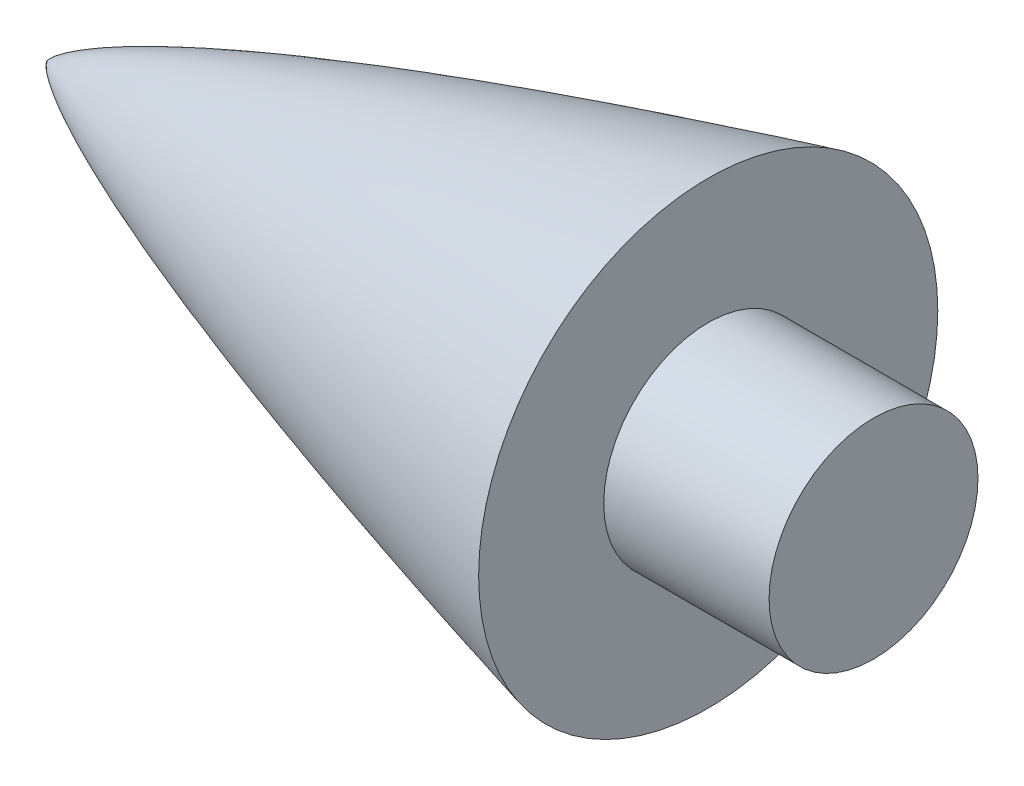
from build123d import *

# Parameters (mm, degrees)
SKETCH5_W           = 40
SKETCH5_H           = 13.888133248
SKETCH6_R           = 6.32
BOSS_EXTRUDE1_DEPTH = 10


with BuildPart() as part:
    # Sketch4 → Revolve3 (revolve)
    with BuildSketch(Plane(origin=(0, 0, 0), x_dir=(1, 0, 0), z_dir=(0, 1, 0))):
        with BuildLine():
            Line((0, 0), (700, 0))
            Line((700, 0), (700, 92))
            add(Edge.make_bspline(
                [(0, 0), (0.00191147, 0.007452455), (0.006682771, 0.021975667), (0.020319911, 0.049405272), (0.053712312, 0.100813891), (0.106292543, 0.166564672), (0.179361524, 0.244890293), (0.321314168, 0.380305786), (0.489821471, 0.519272356), (0.682008296, 0.663619163), (0.97824001, 0.869271861), (1.381516871, 1.128290995), (2.087665161, 1.540864263), (3.352844681, 2.20038034), (5.559362022, 3.217605874), (9.551431072, 4.830778204), (16.8107271, 7.377330859), (28.917425512, 11.039410523), (45.357311817, 15.359469167), (65.219754515, 20.019307373), (92.239595195, 25.797411612), (124.65879636, 32.080212127), (162.600367905, 38.763077948), (206.074460711, 45.728609064), (249.632824355, 52.143059314), (293.258988419, 58.07761177), (336.942021596, 63.576842057), (380.674593437, 68.666747534), (424.45146039, 73.360146302), (468.268944021, 77.658075094), (512.124428867, 81.549646326), (556.016196354, 85.009603585), (594.452384, 87.618355269), (627.419605801, 89.502855515), (653.668023827, 90.726417336), (671.057263835, 91.380719564), (685.081182637, 91.780411211), (693.605741334, 91.941702123), (697.868499327, 91.993335353), (700, 92)],
                knots=[0, 0, 0, 0, 0, 4.3185e-05, 8.637e-05, 0.000172741, 0.000345481, 0.000518222, 0.000690962, 0.001280476, 0.001578086, 0.001875696, 0.002727788, 0.00398729, 0.006196413, 0.009932334, 0.016447975, 0.028301339, 0.049639657, 0.081363194, 0.112451539, 0.143539883, 0.205716599, 0.267893307, 0.330070016, 0.392246725, 0.454423434, 0.516600142, 0.578776854, 0.640953563, 0.703130272, 0.765306983, 0.827483692, 0.889660402, 0.920748757, 0.951837113, 0.975918556, 0.987959278, 1, 1, 1, 1, 1], degree=4))
        make_face()
    revolve(axis=Axis((0, 0, 0), (1, 0, 0)))


with BuildPart() as body_2:
    # Sketch5 → Revolve5 (revolve)
    with BuildSketch(Plane.XY, mode=Mode.PRIVATE) as revolve5_sk:
        with Locations((20, 6.944066624)):
            Rectangle(SKETCH5_W, SKETCH5_H)
    revolve(revolve5_sk.sketch.rotate(Axis((0, 0, 0), (1, 0, 0)), 90), axis=Axis((0, 0, 0), (1, 0, 0)))

    # Combine1: intersect part
    add(part.part, mode=Mode.INTERSECT)

    # Sketch6 → Boss-Extrude1 (add)
    with BuildSketch(Plane(origin=(40, 0, 0), x_dir=(0, 0, -1), z_dir=(1, 0, 0))):
        with Locations(Location((0, 0, 0), (0, 0, 180))):
            Circle(SKETCH6_R)
    extrude(amount=BOSS_EXTRUDE1_DEPTH)


solid = body_2.part
